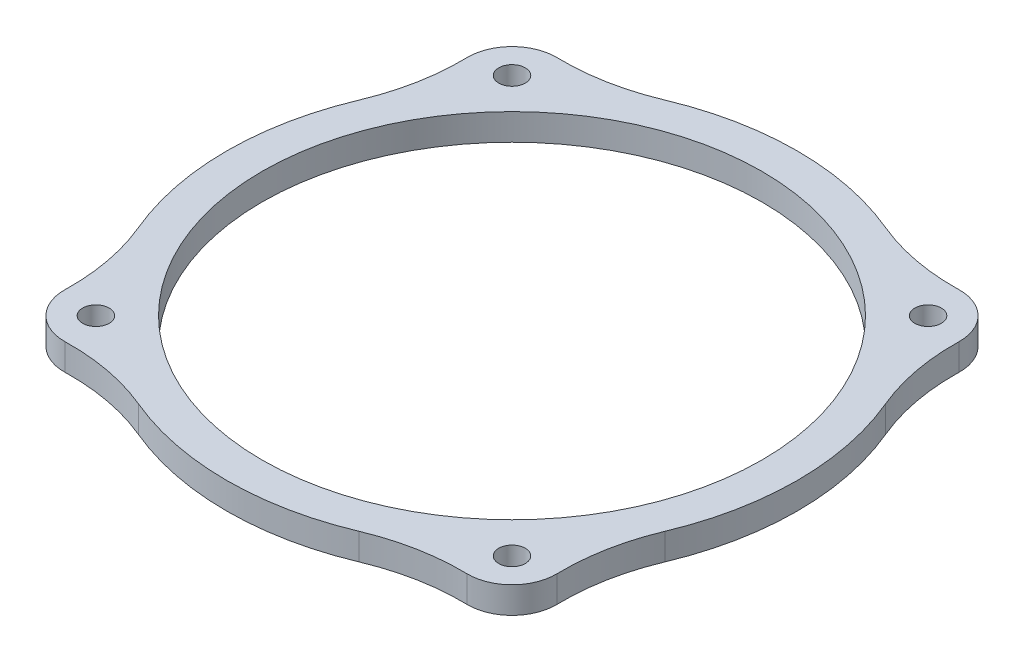
from build123d import *

# Parameters (mm, degrees)
SKETCH1_R           = 28.25
SKETCH1_R_2         = 1.5
BOSS_EXTRUDE1_DEPTH = 3
FILLET1_R           = 25


with BuildPart() as part:
    # Sketch1 → Boss-Extrude1 (new body)
    with BuildSketch(Plane(origin=(0, 0, 0), x_dir=(1, 0, 0), z_dir=(0, 1, 0))):
        with BuildLine():
            ThreePointArc((-19.00522636, 26.055016235), (0, 32.25), (19.00522636, 26.055016235))
            ThreePointArc((19.00522636, 26.055016235), (26.339727599, 26.339727599), (26.055016235, 19.00522636))
            ThreePointArc((26.055016235, 19.00522636), (32.25, 0), (26.055016235, -19.00522636))
            ThreePointArc((26.055016235, -19.00522636), (26.339727599, -26.339727599), (19.00522636, -26.055016235))
            ThreePointArc((19.00522636, -26.055016235), (0, -32.25), (-19.00522636, -26.055016235))
            ThreePointArc((-19.00522636, -26.055016235), (-26.339727599, -26.339727599), (-26.055016235, -19.00522636))
            ThreePointArc((-26.055016235, -19.00522636), (-32.25, 0), (-26.055016235, 19.00522636))
            ThreePointArc((-26.055016235, 19.00522636), (-26.339727599, 26.339727599), (-19.00522636, 26.055016235))
        make_face()
        with Locations(Location((0, 0, 0), (0, 0, 270))):
            Circle(SKETCH1_R, mode=Mode.SUBTRACT)
        with Locations(Location((23.511300474, 23.511300474, 0), (0, 0, 270))):
            Circle(SKETCH1_R_2, mode=Mode.SUBTRACT)
        with Locations(Location((23.511300474, -23.511300474, 0), (0, 0, 270))):
            Circle(SKETCH1_R_2, mode=Mode.SUBTRACT)
        with Locations(Location((-23.511300474, -23.511300474, 0), (0, 0, 270))):
            Circle(SKETCH1_R_2, mode=Mode.SUBTRACT)
        with Locations(Location((-23.511300474, 23.511300474, 0), (0, 0, 270))):
            Circle(SKETCH1_R_2, mode=Mode.SUBTRACT)
    extrude(amount=BOSS_EXTRUDE1_DEPTH)

    # Fillet1
    fillet1_edges = [part.edges().sort_by_distance(p)[0] for p in [
        (-19.00522636, 1.5, -26.055016235),
        (19.00522636, 1.5, -26.055016235),
        (26.055016235, 1.5, -19.00522636),
        (26.055016235, 1.5, 19.00522636),
        (19.00522636, 1.5, 26.055016235),
        (-19.00522636, 1.5, 26.055016235),
        (-26.055016235, 1.5, 19.00522636),
        (-26.055016235, 1.5, -19.00522636),
    ]]
    fillet(fillet1_edges, radius=FILLET1_R)


solid = part.part
